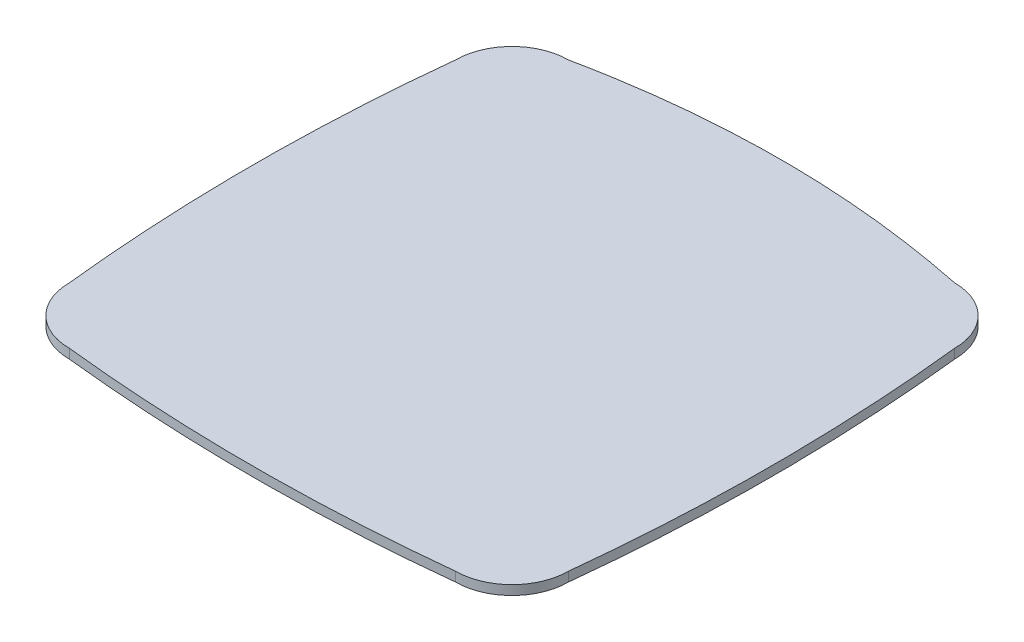
from build123d import *

# Parameters (mm, degrees)
BOSS_EXTRUDE1_DEPTH = 1.27


with BuildPart() as part:
    # Sketch1 → Boss-Extrude1 (new body)
    with BuildSketch(Plane(origin=(0, 0, 0), x_dir=(1, 0, 0), z_dir=(0, 1, 0))):
        with BuildLine():
            ThreePointArc((26.035, 33.655), (31.423153673, 31.423153673), (33.655, 26.035))
            add(Edge.make_bspline(
                [(33.655, 26.035), (36.449, 0), (33.655, -26.035)],
                knots=[0, 0, 0, 1, 1, 1], degree=2))
            ThreePointArc((33.655, -26.035), (31.423153673, -31.423153673), (26.035, -33.655))
            add(Edge.make_bspline(
                [(-26.035, -33.655), (0, -36.449), (26.035, -33.655)],
                knots=[0, 0, 0, 1, 1, 1], degree=2))
            ThreePointArc((-26.035, -33.655), (-31.423153673, -31.423153673), (-33.655, -26.035))
            add(Edge.make_bspline(
                [(-33.655, 26.035), (-36.449, 0), (-33.655, -26.035)],
                knots=[0, 0, 0, 1, 1, 1], degree=2))
            ThreePointArc((-33.655, 26.035), (-31.423153673, 31.423153673), (-26.035, 33.655))
            add(Edge.make_bspline(
                [(-26.035, 33.655), (0, 39.037083155), (26.035, 33.655)],
                knots=[0, 0, 0, 1, 1, 1], degree=2))
        make_face()
    extrude(amount=BOSS_EXTRUDE1_DEPTH)


solid = part.part
